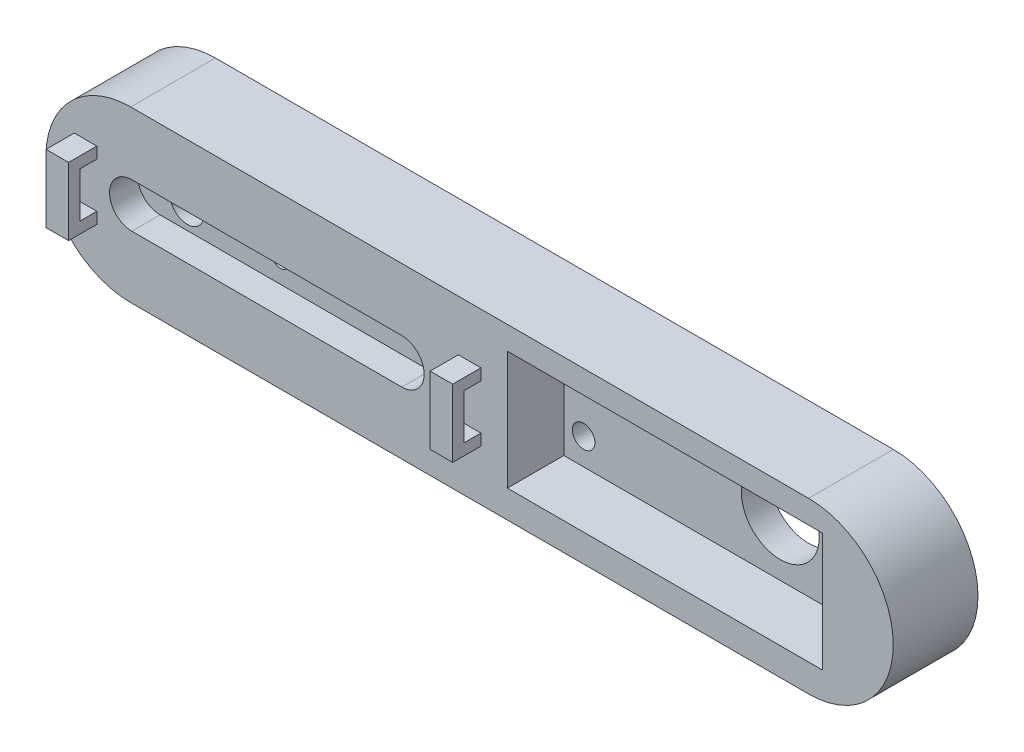
from build123d import *

# Parameters (mm, degrees)
BOSS_EXTRUDE1_DEPTH = 15
SKETCH2_R           = 3
CUT_EXTRUDE1_DEPTH  = 10
SKETCH3_W           = 55.8
SKETCH3_H           = 21
CUT_EXTRUDE2_DEPTH  = 10
SKETCH4_R           = 6.9
SKETCH4_R_2         = 2
CUT_EXTRUDE3_DEPTH  = 5
CUT_EXTRUDE4_DEPTH  = 5
SKETCH7_R           = 3
CUT_EXTRUDE5_DEPTH  = 2
CUT_EXTRUDE6_DEPTH  = 3
SKETCH9_R           = 6.5
CUT_EXTRUDE7_DEPTH  = 3
SKETCH11_W          = 4
SKETCH11_H          = 12
BOSS_EXTRUDE2_DEPTH = 5
CUT_EXTRUDE9_DEPTH  = 4
SKETCH14_W          = 4
SKETCH14_H          = 12
BOSS_EXTRUDE3_DEPTH = 5
SKETCH15_W          = 3
SKETCH15_H          = 8
CUT_EXTRUDE10_DEPTH = 4
SKETCH16_R          = 1.5
CUT_EXTRUDE11_DEPTH = 7


with BuildPart() as part:
    # Sketch1 → Boss-Extrude1 (new body)
    with BuildSketch(Plane.XY):
        with BuildLine():
            Line((60, -15), (-60, -15))
            ThreePointArc((-60, -15), (-75, 0), (-60, 15))
            Line((-60, 15), (60, 15))
            ThreePointArc((60, 15), (75, 0), (60, -15))
        make_face()
    extrude(amount=BOSS_EXTRUDE1_DEPTH)

    # Sketch2 → Cut-Extrude1 (cut)
    with BuildSketch(Plane(origin=(0, 0, 0), x_dir=(-1, 0, 0), z_dir=(0, 0, -1))):
        with Locations((55, 0)):
            Circle(SKETCH2_R)
    extrude(amount=-CUT_EXTRUDE1_DEPTH, mode=Mode.SUBTRACT)

    # Sketch3 → Cut-Extrude2 (cut)
    with BuildSketch(Plane.XY.offset(15)):
        with Locations((34.58, 0.4)):
            Rectangle(SKETCH3_W, SKETCH3_H)
    extrude(amount=-CUT_EXTRUDE2_DEPTH, mode=Mode.SUBTRACT)

    # Sketch4 → Cut-Extrude3 (cut)
    with BuildSketch(Plane.XY.offset(5)):
        with Locations((45, 0)):
            Circle(SKETCH4_R)
        with Locations((58.98, -5.4)):
            Circle(SKETCH4_R_2)
        with Locations((58.98, 4.6)):
            Circle(SKETCH4_R_2)
        with Locations((10.18, 4.6)):
            Circle(SKETCH4_R_2)
        with Locations((10.18, -5.4)):
            Circle(SKETCH4_R_2)
    extrude(amount=-CUT_EXTRUDE3_DEPTH, mode=Mode.SUBTRACT)

    # Sketch6 → Cut-Extrude4 (cut)
    with BuildSketch(Plane.XY.offset(15)):
        with BuildLine():
            Line((-59.79767324, 3.94890295), (-12, 3.94890295))
            ThreePointArc((-12, 3.94890295), (-8.05109705, 0), (-12, -3.94890295))
            Line((-12, -3.94890295), (-59.79767324, -3.94890295))
            ThreePointArc((-59.79767324, -3.94890295), (-63.74657619, 0), (-59.79767324, 3.94890295))
        make_face()
    extrude(amount=-CUT_EXTRUDE4_DEPTH, mode=Mode.SUBTRACT)

    # Sketch7 → Cut-Extrude5 (cut)
    with BuildSketch(Plane(origin=(0, 0, 0), x_dir=(-1, 0, 0), z_dir=(0, 0, -1))):
        with Locations((-58.98, 4.6)):
            Circle(SKETCH7_R)
        with Locations((-58.98, -5.4)):
            Circle(SKETCH7_R)
        with Locations((-10.18, 4.6)):
            Circle(SKETCH7_R)
        with Locations((-10.18, -5.4)):
            Circle(SKETCH7_R)
    extrude(amount=-CUT_EXTRUDE5_DEPTH, mode=Mode.SUBTRACT)

    # Sketch8 → Cut-Extrude6 (cut)
    with BuildSketch(Plane(origin=(0, 0, 0), x_dir=(-1, 0, 0), z_dir=(0, 0, -1))):
        with BuildLine():
            Line((40, 4.65), (70, 4.65))
            ThreePointArc((70, 4.65), (74.65, 0), (70, -4.65))
            Line((70, -4.65), (40, -4.65))
            ThreePointArc((40, -4.65), (35.35, 0), (40, 4.65))
        make_face()
    extrude(amount=-CUT_EXTRUDE6_DEPTH, mode=Mode.SUBTRACT)

    # Sketch9 → Cut-Extrude7 (cut)
    with BuildSketch(Plane(origin=(0, 0, 0), x_dir=(-1, 0, 0), z_dir=(0, 0, -1))):
        with Locations((55, 0)):
            Circle(SKETCH9_R)
    extrude(amount=-CUT_EXTRUDE7_DEPTH, mode=Mode.SUBTRACT)

    # Sketch11 → Boss-Extrude2 (add)
    with BuildSketch(Plane.XY.offset(15)):
        Rectangle(SKETCH11_W, SKETCH11_H)
    extrude(amount=BOSS_EXTRUDE2_DEPTH)

    # Sketch13 → Cut-Extrude9 (cut)
    with BuildSketch(Plane(origin=(2, 0, 0), x_dir=(0, 0, -1), z_dir=(1, 0, 0))):
        Polygon((-15, 0), (-15, 4), (-18, 4), (-18, -4), (-15, -4), align=None)
    extrude(amount=-CUT_EXTRUDE9_DEPTH, mode=Mode.SUBTRACT)

    # Sketch14 → Boss-Extrude3 (add)
    with BuildSketch(Plane.XY.offset(15)):
        with Locations((-68, 0)):
            Rectangle(SKETCH14_W, SKETCH14_H)
    extrude(amount=BOSS_EXTRUDE3_DEPTH)

    # Sketch15 → Cut-Extrude10 (cut)
    with BuildSketch(Plane(origin=(-66, 0, 0), x_dir=(0, 0, -1), z_dir=(1, 0, 0))):
        with Locations((-16.5, 0)):
            Rectangle(SKETCH15_W, SKETCH15_H)
    extrude(amount=-CUT_EXTRUDE10_DEPTH, mode=Mode.SUBTRACT)

    # Sketch16 → Cut-Extrude11 (cut)
    with BuildSketch(Plane(origin=(0, 0, 3), x_dir=(-1, 0, 0), z_dir=(0, 0, -1))):
        with Locations((38.5, 0)):
            Circle(SKETCH16_R)
    extrude(amount=-CUT_EXTRUDE11_DEPTH, mode=Mode.SUBTRACT)


solid = part.part
